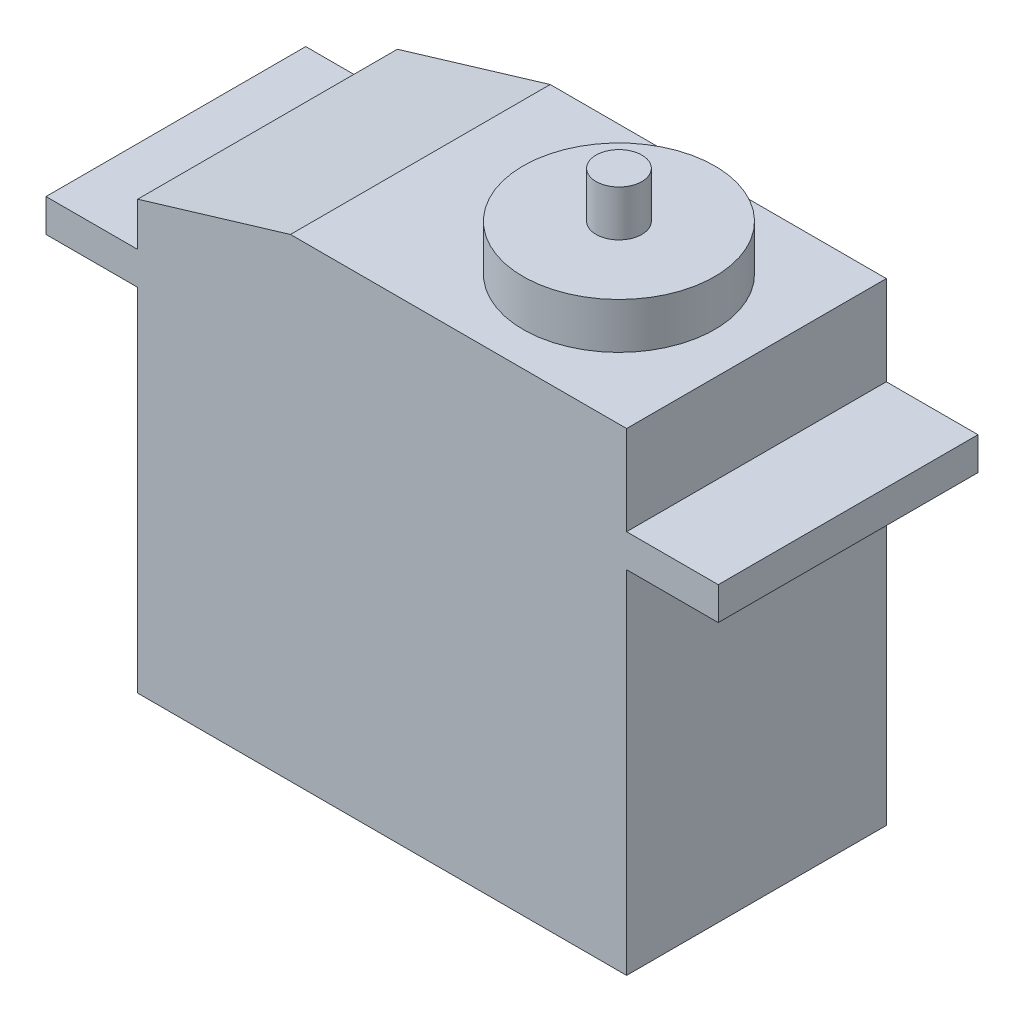
from build123d import *

# Parameters (mm, degrees)
BOSS_EXTRUDE1_DEPTH = 17
SKETCH2_W           = 44
SKETCH2_H           = 17
BOSS_EXTRUDE2_DEPTH = 2.15
SKETCH3_R           = 6.275
BOSS_EXTRUDE3_DEPTH = 3
SKETCH4_R           = 1.5
BOSS_EXTRUDE4_DEPTH = 3


with BuildPart() as part:
    # Sketch1 → Boss-Extrude1 (new body)
    with BuildSketch(Plane.XY):
        Polygon((-16, 12.5), (-6, 15.5), (16, 15.5), (16, -15.5), (-16, -15.5), align=None)
    extrude(amount=-BOSS_EXTRUDE1_DEPTH)

    # Sketch2 → Boss-Extrude2 (add)
    with BuildSketch(Plane(origin=(0, 7.5, 0), x_dir=(1, 0, 0), z_dir=(0, 1, 0))):
        with Locations((0, 8.5)):
            Rectangle(SKETCH2_W, SKETCH2_H)
    extrude(amount=BOSS_EXTRUDE2_DEPTH)

    # Sketch3 → Boss-Extrude3 (add)
    with BuildSketch(Plane(origin=(0, 15.5, 0), x_dir=(1, 0, 0), z_dir=(0, 1, 0))):
        with Locations(Location((7, 8.5, 0), (0, 0, 180))):
            Circle(SKETCH3_R)
    extrude(amount=BOSS_EXTRUDE3_DEPTH)

    # Sketch4 → Boss-Extrude4 (add)
    with BuildSketch(Plane(origin=(0, 18.5, 0), x_dir=(1, 0, 0), z_dir=(0, 1, 0))):
        with Locations(Location((7, 8.5, 0), (0, 0, 180))):
            Circle(SKETCH4_R)
    extrude(amount=BOSS_EXTRUDE4_DEPTH)


solid = part.part
